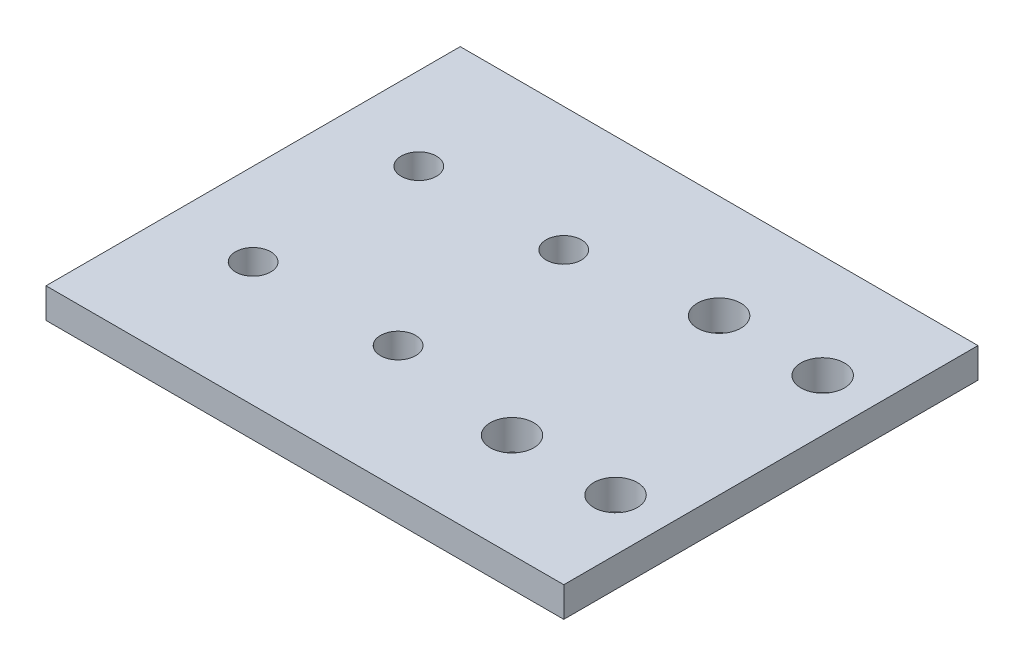
from build123d import *

# Parameters (mm, degrees)
SKETCH_1_R          = 1.7
SKETCH_1_W          = 5
SKETCH_1_H          = 13
SKETCH_1_H_2        = 2
EXTRUDE_3_DEPTH     = 2.9
SKETCH_3_R          = 2.1
CUT_EXTRUDE_3_DEPTH = 2.9


with BuildPart() as part:
    # 草图1 → 凸台-拉伸3 (new body)
    # profile 1 of 10: a face of its own
    with BuildSketch(Plane(origin=(0, 0, 0), x_dir=(1, 0, 0), z_dir=(0, 1, 0))):
        with BuildLine():
            Line((-40, 113), (-70, 113))
            Line((-70, 113), (-70, 108))
            Line((-70, 108), (-70, 92))
            Line((-70, 92), (-63.7, 92))
            ThreePointArc((-63.7, 92), (-62, 93.7), (-60.3, 92))
            ThreePointArc((-60.3, 92), (-60.797918472, 90.797918472), (-62, 90.3))
            Line((-62, 90.3), (-62, 87))
            Line((-62, 87), (-48, 87))
            Line((-48, 87), (-48, 90.3))
            ThreePointArc((-48, 90.3), (-49.202081528, 93.202081528), (-46.3, 92))
            Line((-46.3, 92), (-40, 92))
            Line((-40, 92), (-40, 113))
        make_face()
        with Locations(Location((-62, 108, 0), (0, 0, 270))):
            Circle(SKETCH_1_R, mode=Mode.SUBTRACT)
        with Locations(Location((-48, 108, 0), (0, 0, 270))):
            Circle(SKETCH_1_R, mode=Mode.SUBTRACT)
    # profile 2 of 10: a face of its own
    with BuildSketch(Plane(origin=(0, 0, 0), x_dir=(1, 0, 0), z_dir=(0, 1, 0))):
        with BuildLine():
            Line((-70, 92), (-70, 87))
            Line((-70, 87), (-62, 87))
            Line((-62, 87), (-62, 90.3))
            ThreePointArc((-62, 90.3), (-63.202081528, 90.797918472), (-63.7, 92))
            Line((-63.7, 92), (-70, 92))
        make_face()
    # profile 3 of 10: a face of its own
    with BuildSketch(Plane(origin=(0, 0, 0), x_dir=(1, 0, 0), z_dir=(0, 1, 0))):
        with BuildLine():
            Line((-48, 90.3), (-48, 87))
            Line((-48, 87), (-40, 87))
            Line((-40, 87), (-40, 92))
            Line((-40, 92), (-46.3, 92))
            ThreePointArc((-46.3, 92), (-46.797918472, 90.797918472), (-48, 90.3))
        make_face()
    # profile 4 of 10: a face of its own
    with BuildSketch(Plane(origin=(0, 0, 0), x_dir=(1, 0, 0), z_dir=(0, 1, 0))):
        Polygon((-70, 87), (-70, 80), (-20, 80), (-20, 85), (-25, 85), (-25, 87), (-40, 87), (-48, 87), (-62, 87), align=None)
    # profile 5 of 10: a face of its own
    with BuildSketch(Plane(origin=(0, 0, 0), x_dir=(1, 0, 0), z_dir=(0, 1, 0))):
        Polygon((-25, 113), (-40, 113), (-40, 92), (-40, 87), (-25, 87), (-25, 100), align=None)
    # profile 6 of 10: a face of its own
    with BuildSketch(Plane(origin=(0, 0, 0), x_dir=(1, 0, 0), z_dir=(0, 1, 0))):
        with Locations((-22.5, 93.5)):
            Rectangle(SKETCH_1_W, SKETCH_1_H)
    # profile 7 of 10: a face of its own
    with BuildSketch(Plane(origin=(0, 0, 0), x_dir=(1, 0, 0), z_dir=(0, 1, 0))):
        with Locations((-22.5, 106.5)):
            Rectangle(SKETCH_1_W, SKETCH_1_H)
    # profile 8 of 10: a face of its own
    with BuildSketch(Plane(origin=(0, 0, 0), x_dir=(1, 0, 0), z_dir=(0, 1, 0))):
        with Locations((-22.5, 86)):
            Rectangle(SKETCH_1_W, SKETCH_1_H_2)
    # profile 9 of 10: a face of its own
    with BuildSketch(Plane(origin=(0, 0, 0), x_dir=(1, 0, 0), z_dir=(0, 1, 0))):
        Polygon((-20, 120), (-70, 120), (-70, 113), (-40, 113), (-25, 113), (-25, 115), (-20, 115), align=None)
    # profile 10 of 10: a face of its own
    with BuildSketch(Plane(origin=(0, 0, 0), x_dir=(1, 0, 0), z_dir=(0, 1, 0))):
        with Locations((-22.5, 114)):
            Rectangle(SKETCH_1_W, SKETCH_1_H_2)
    extrude(amount=EXTRUDE_3_DEPTH)

    # 草图3 → 切除-拉伸3 (cut)
    with BuildSketch(Plane(origin=(0, 2.9, 0), x_dir=(1, 0, 0), z_dir=(0, 1, 0))):
        with Locations(Location((-25, 110, 0), (0, 0, 270))):
            Circle(SKETCH_3_R)
        with Locations(Location((-25, 90, 0), (0, 0, 270))):
            Circle(SKETCH_3_R)
        with Locations(Location((-35, 90, 0), (0, 0, 270))):
            Circle(SKETCH_3_R)
        with Locations(Location((-35, 110, 0), (0, 0, 270))):
            Circle(SKETCH_3_R)
    extrude(amount=-CUT_EXTRUDE_3_DEPTH, mode=Mode.SUBTRACT)


solid = part.part
